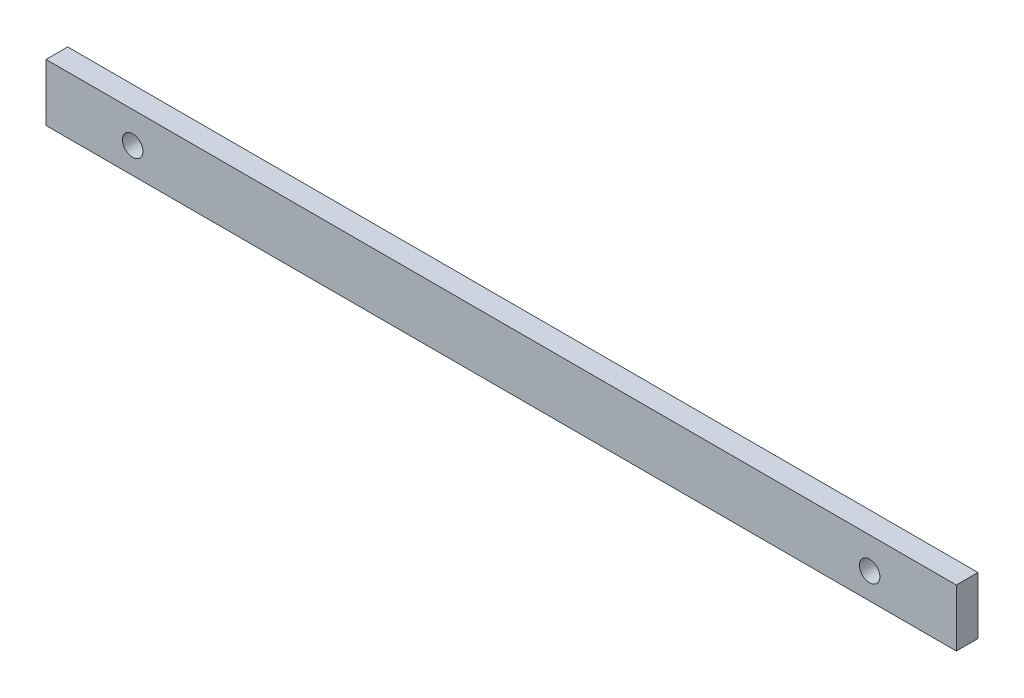
from build123d import *

# Parameters (mm, degrees)
SKETCH3_W           = 3.175
SKETCH3_H           = 8.382
SKETCH3_W_2         = 127
SKETCH3_R           = 1.5
BOSS_EXTRUDE1_DEPTH = 3.175


with BuildPart() as part:
    # Sketch3 → Boss-Extrude1 (new body)
    # profile 1 of 3: a face of its own
    with BuildSketch(Plane.XY):
        with Locations((-65.0875, 0)):
            Rectangle(SKETCH3_W, SKETCH3_H)
    # profile 2 of 3: a face of its own
    with BuildSketch(Plane.XY):
        Rectangle(SKETCH3_W_2, SKETCH3_H)
        with Locations((53.975, -0.381)):
            Circle(SKETCH3_R, mode=Mode.SUBTRACT)
        with Locations((-53.975, -0.381)):
            Circle(SKETCH3_R, mode=Mode.SUBTRACT)
    # profile 3 of 3: a face of its own
    with BuildSketch(Plane.XY):
        with Locations((65.0875, 0)):
            Rectangle(SKETCH3_W, SKETCH3_H)
    extrude(amount=BOSS_EXTRUDE1_DEPTH)


solid = part.part
